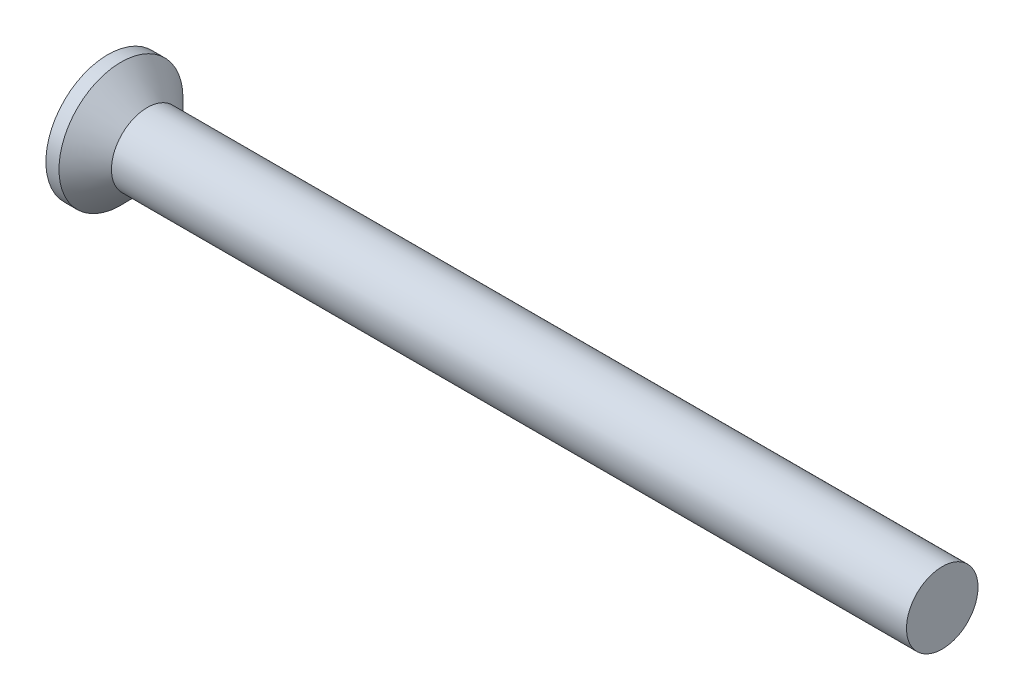
from build123d import *

# Parameters (mm, degrees)
CROSSRECESS_DEPTH = 0.825
DRAFT9_ANGLE      = 30
FILLET5_R         = 0.3


with BuildPart() as part:
    # Sketch1 → Base (revolve)
    with BuildSketch(Plane.XY, mode=Mode.PRIVATE) as base_sk:
        Polygon((35, 1.5), (2.65, 1.5), (1.65, 1.5), (0.55, 2.6), (0, 2.6), (0, 0), (35, 0), align=None)
    revolve(base_sk.sketch.rotate(Axis((4.515812911, 0, 0), (-1, 0, 0)), 90), axis=Axis((4.515812911, 0, 0), (-1, 0, 0)))

    # Sketch6 → CrossRecess (cut)
    with BuildSketch(Plane(origin=(0, 0, 0), x_dir=(0, 0, -1), z_dir=(1, 0, 0))):
        Polygon((0.32, 0.32), (0.32, 1.6), (-0.32, 1.6), (-0.32, 0.32), (-1.6, 0.32), (-1.6, -0.32), (-0.32, -0.32), (-0.32, -1.6), (0.32, -1.6), (0.32, -0.32), (1.6, -0.32), (1.6, 0.32), align=None)
    extrude(amount=CROSSRECESS_DEPTH, mode=Mode.SUBTRACT)

    # Draft9
    draft9_faces = [part.faces().sort_by_distance(p)[0] for p in [
        (0.4125, 1.6, 0),
        (0.4125, 0, 1.6),
        (0.4125, -1.6, 0),
        (0.4125, 0, -1.6),
    ]]
    draft(draft9_faces, Plane(origin=(0, 2.6, 0), x_dir=(0, 0, -1), z_dir=(-1, 0, 0)), DRAFT9_ANGLE)

    # Fillet5
    fillet5_edges = [part.edges().sort_by_distance(p)[0] for p in [
        (0.4125, 0.32, 0.32),
        (0.4125, -0.32, 0.32),
        (0.4125, -0.32, -0.32),
        (0.4125, 0.32, -0.32),
    ]]
    fillet(fillet5_edges, radius=FILLET5_R)


solid = part.part
